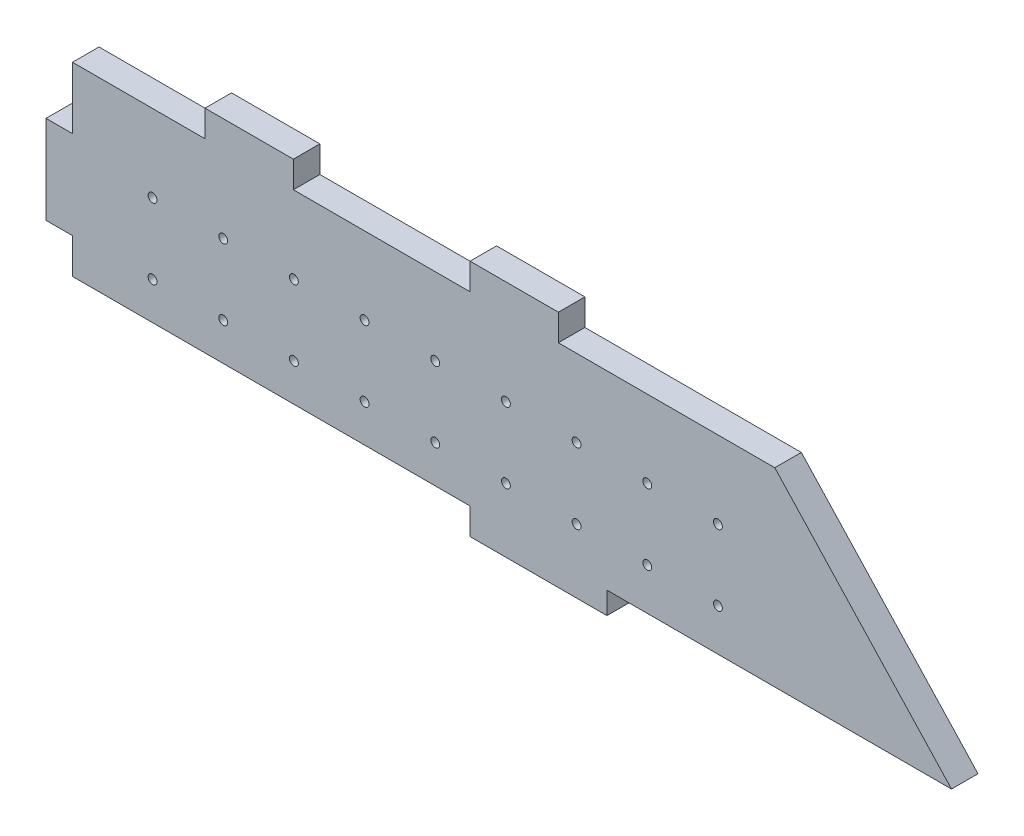
from build123d import *

# Parameters (mm, degrees)
ESQUISSE1_W             = 199
ESQUISSE1_H             = 48
BOSS_EXTRU_1_DEPTH      = 6
ESQUISSE2_W             = 20
ESQUISSE2_H             = 6
BOSS_EXTRU_2_DEPTH      = 6
ESQUISSE3_W             = 6
ESQUISSE3_H             = 20
BOSS_EXTRU_3_DEPTH      = 6
ESQUISSE4_W             = 78
ESQUISSE4_H             = 5
ENL_V_MAT_EXTRU_1_DEPTH = 213.077815907
ENL_V_MAT_EXTRU_2_DEPTH = 213.077815907
ESQUISSE6_R             = 1.005
ENL_V_MAT_EXTRU_3_DEPTH = 213.077815907
ESQUISSE7_R             = 2
ENL_V_MAT_EXTRU_4_DEPTH = 3
ESQUISSE8_W             = 90
ESQUISSE8_H             = 6
ENL_V_MAT_EXTRU_5_DEPTH = 213.077815907


with BuildPart() as part:
    # Esquisse1 → Boss.-Extru.1 (new body)
    with BuildSketch(Plane.XY):
        with Locations((-99.5, 24)):
            Rectangle(ESQUISSE1_W, ESQUISSE1_H)
    extrude(amount=BOSS_EXTRU_1_DEPTH)

    # Esquisse2 → Boss.-Extru.2 (add)
    with BuildSketch(Plane(origin=(0, 48, 0), x_dir=(1, 0, 0), z_dir=(0, 1, 0))):
        with Locations((-99, -3)):
            Rectangle(ESQUISSE2_W, ESQUISSE2_H)
        with Locations((-159, -3)):
            Rectangle(ESQUISSE2_W, ESQUISSE2_H)
    extrude(amount=BOSS_EXTRU_2_DEPTH)

    # Esquisse3 → Boss.-Extru.3 (add)
    with BuildSketch(Plane.ZY.offset(199)):
        with Locations((3, 24)):
            Rectangle(ESQUISSE3_W, ESQUISSE3_H)
    extrude(amount=BOSS_EXTRU_3_DEPTH)

    # Esquisse4 → Enlèv. mat.-Extru.1 (cut, through all)
    with BuildSketch(Plane.XY.offset(6)):
        with Locations((-39, 2.5)):
            Rectangle(ESQUISSE4_W, ESQUISSE4_H)
    extrude(amount=-ENL_V_MAT_EXTRU_1_DEPTH, mode=Mode.SUBTRACT)

    # Esquisse5 → Enlèv. mat.-Extru.2 (cut, through all)
    with BuildSketch(Plane.XY.offset(6)):
        Polygon((0, 48), (-40, 48), (0, 5), align=None)
    extrude(amount=-ENL_V_MAT_EXTRU_2_DEPTH, mode=Mode.SUBTRACT)

    # Esquisse6 → Enlèv. mat.-Extru.3 (cut, through all)
    with BuildSketch(Plane.XY.offset(6)):
        with Locations((-148.88, 14.5)):
            Circle(ESQUISSE6_R)
        with Locations((-148.88, 30.5)):
            Circle(ESQUISSE6_R)
        with Locations((-132.88, 14.5)):
            Circle(ESQUISSE6_R)
        with Locations((-132.88, 30.5)):
            Circle(ESQUISSE6_R)
        with Locations((-116.88, 14.5)):
            Circle(ESQUISSE6_R)
        with Locations((-116.88, 30.5)):
            Circle(ESQUISSE6_R)
        with Locations((-100.88, 14.5)):
            Circle(ESQUISSE6_R)
        with Locations((-100.88, 30.5)):
            Circle(ESQUISSE6_R)
        with Locations((-84.88, 14.5)):
            Circle(ESQUISSE6_R)
        with Locations((-84.88, 30.5)):
            Circle(ESQUISSE6_R)
        with Locations((-68.88, 14.5)):
            Circle(ESQUISSE6_R)
        with Locations((-68.88, 30.5)):
            Circle(ESQUISSE6_R)
        with Locations((-52.88, 14.5)):
            Circle(ESQUISSE6_R)
        with Locations((-52.88, 30.5)):
            Circle(ESQUISSE6_R)
        with Locations((-164.88, 14.5)):
            Circle(ESQUISSE6_R)
        with Locations((-164.88, 30.5)):
            Circle(ESQUISSE6_R)
        with Locations((-180.88, 14.5)):
            Circle(ESQUISSE6_R)
        with Locations((-180.88, 30.5)):
            Circle(ESQUISSE6_R)
    extrude(amount=-ENL_V_MAT_EXTRU_3_DEPTH, mode=Mode.SUBTRACT)

    # Esquisse7 → Enlèv. mat.-Extru.4 (cut)
    with BuildSketch(Plane(origin=(0, 0, 0), x_dir=(-1, 0, 0), z_dir=(0, 0, -1))):
        with Locations((180.88, 14.5)):
            Circle(ESQUISSE7_R)
        with Locations((180.88, 30.5)):
            Circle(ESQUISSE7_R)
        with Locations((164.88, 14.5)):
            Circle(ESQUISSE7_R)
        with Locations((164.88, 30.5)):
            Circle(ESQUISSE7_R)
        with Locations((148.88, 14.5)):
            Circle(ESQUISSE7_R)
        with Locations((148.88, 30.5)):
            Circle(ESQUISSE7_R)
        with Locations((132.88, 14.5)):
            Circle(ESQUISSE7_R)
        with Locations((132.88, 30.5)):
            Circle(ESQUISSE7_R)
        with Locations((116.88, 14.5)):
            Circle(ESQUISSE7_R)
        with Locations((116.88, 30.5)):
            Circle(ESQUISSE7_R)
        with Locations((100.88, 14.5)):
            Circle(ESQUISSE7_R)
        with Locations((100.88, 30.5)):
            Circle(ESQUISSE7_R)
        with Locations((84.88, 14.5)):
            Circle(ESQUISSE7_R)
        with Locations((84.88, 30.5)):
            Circle(ESQUISSE7_R)
        with Locations((68.88, 14.5)):
            Circle(ESQUISSE7_R)
        with Locations((68.88, 30.5)):
            Circle(ESQUISSE7_R)
        with Locations((52.88, 14.5)):
            Circle(ESQUISSE7_R)
        with Locations((52.88, 30.5)):
            Circle(ESQUISSE7_R)
    extrude(amount=-ENL_V_MAT_EXTRU_4_DEPTH, mode=Mode.SUBTRACT)

    # Esquisse8 → Enlèv. mat.-Extru.5 (cut, through all)
    with BuildSketch(Plane.XY.offset(6)):
        with Locations((-154, 3)):
            Rectangle(ESQUISSE8_W, ESQUISSE8_H)
    extrude(amount=-ENL_V_MAT_EXTRU_5_DEPTH, mode=Mode.SUBTRACT)


solid = part.part
